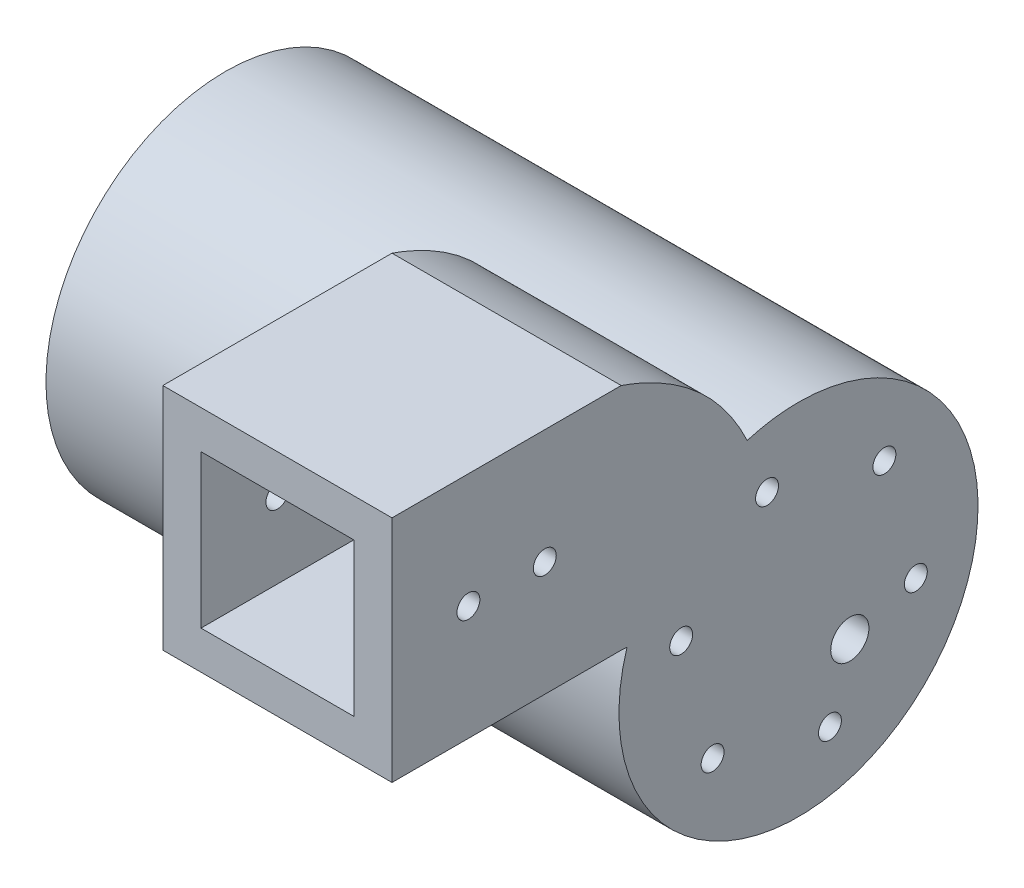
from build123d import *

# Parameters (mm, degrees)
SKETCH1_W           = 30
SKETCH1_H           = 30
SKETCH1_W_2         = 20
SKETCH1_H_2         = 20
BOSS_EXTRUDE1_DEPTH = 30
SKETCH21_R          = 1.5
CUT_EXTRUDE1_DEPTH  = 46
SKETCH22_W          = 30
SKETCH22_H          = 30
BOSS_EXTRUDE2_DEPTH = 5
BOSS_EXTRUDE4_DEPTH = 15
SKETCH26_R          = 23.5
BOSS_EXTRUDE5_DEPTH = 75
SKETCH27_R          = 18.9
CUT_EXTRUDE2_DEPTH  = 100.378046072
SKETCH28_R          = 18.9
BOSS_EXTRUDE6_DEPTH = 5
SKETCH29_R          = 1.5
SKETCH29_R_2        = 2.5
CUT_EXTRUDE3_DEPTH  = 8


with BuildPart() as part:
    # Sketch1 → Boss-Extrude1 (new body)
    with BuildSketch(Plane.XY):
        Rectangle(SKETCH1_W, SKETCH1_H)
        Rectangle(SKETCH1_W_2, SKETCH1_H_2, mode=Mode.SUBTRACT)
    extrude(amount=BOSS_EXTRUDE1_DEPTH)

    # Sketch21 → Cut-Extrude1 (cut, through all)
    with BuildSketch(Plane(origin=(15, 0, 0), x_dir=(0, 0, -1), z_dir=(1, 0, 0))):
        with Locations(Location((-10, 0, 0), (0, 0, 90))):
            Circle(SKETCH21_R)
        with Locations(Location((-20, 0, 0), (0, 0, 90))):
            Circle(SKETCH21_R)
    extrude(amount=-CUT_EXTRUDE1_DEPTH, mode=Mode.SUBTRACT)

    # Sketch22 → Boss-Extrude2 (add)
    with BuildSketch(Plane(origin=(0, 0, 0), x_dir=(-1, 0, 0), z_dir=(0, 0, -1))):
        Rectangle(SKETCH22_W, SKETCH22_H)
    extrude(amount=-BOSS_EXTRUDE2_DEPTH)

    # Sketch25 → Boss-Extrude4 (add, symmetric)
    with BuildSketch(Plane(origin=(0, 0, 0), x_dir=(0, 0, -1), z_dir=(1, 0, 0))):
        with BuildLine():
            Line((0, 15), (0, -15))
            ThreePointArc((0, -15), (1.913417162, -15.380602337), (3.535533906, -16.464466094))
            Line((3.535533906, -16.464466094), (22.852181054, -35.781113242))
            Line((22.852181054, -35.781113242), (36.994316678, -21.638977618))
            Line((36.994316678, -21.638977618), (17.67766953, -2.32233047))
            add(Edge.make_bspline(
                [(0, 15), (13.071207338, 10.453425887), (17.67766953, -2.32233047)],
                knots=[0, 0, 0, 1, 1, 1], degree=2))
        make_face()
    extrude(amount=BOSS_EXTRUDE4_DEPTH, both=True)

    # Sketch26 → Boss-Extrude5 (add)
    with BuildSketch(Plane(origin=(15, 0, 0), x_dir=(0, 0, -1), z_dir=(1, 0, 0))):
        with Locations(Location((23.205734445, -21.992531009, 0), (0, 0, 90))):
            Circle(SKETCH26_R)
    extrude(amount=-BOSS_EXTRUDE5_DEPTH)

    # Sketch27 → Cut-Extrude2 (cut, through all)
    with BuildSketch(Plane(origin=(15, 0, 0), x_dir=(0, 0, -1), z_dir=(1, 0, 0))):
        with Locations(Location((23.205734445, -21.992531009, 0), (0, 0, 90))):
            Circle(SKETCH27_R)
    extrude(amount=-CUT_EXTRUDE2_DEPTH, mode=Mode.SUBTRACT)

    # Sketch28 → Boss-Extrude6 (add)
    with BuildSketch(Plane(origin=(15, 0, 0), x_dir=(0, 0, -1), z_dir=(1, 0, 0))):
        with Locations(Location((23.205734445, -21.992531009, 0), (0, 0, 90))):
            Circle(SKETCH28_R)
    extrude(amount=-BOSS_EXTRUDE6_DEPTH)

    # Sketch29 → Cut-Extrude3 (cut)
    with BuildSketch(Plane(origin=(15, 0, 0), x_dir=(0, 0, -1), z_dir=(1, 0, 0))):
        with Locations(Location((34.448732265, -10.749533188, 0), (0, 0, 90))):
            Circle(SKETCH29_R)
        with Locations(Location((38.563955083, -26.107753826, 0), (0, 0, 90))):
            Circle(SKETCH29_R)
        with Locations(Location((27.320957262, -37.350751647, 0), (0, 0, 90))):
            Circle(SKETCH29_R)
        with Locations(Location((11.962736624, -33.23552883, 0), (0, 0, 90))):
            Circle(SKETCH29_R)
        with Locations(Location((7.847513807, -17.877308192, 0), (0, 0, 90))):
            Circle(SKETCH29_R)
        with Locations(Location((19.090511627, -6.634310371, 0), (0, 0, 90))):
            Circle(SKETCH29_R)
        with Locations(Location((29.923248866, -28.71004543, 0), (0, 0, 90))):
            Circle(SKETCH29_R_2)
    extrude(amount=-CUT_EXTRUDE3_DEPTH, mode=Mode.SUBTRACT)


solid = part.part
